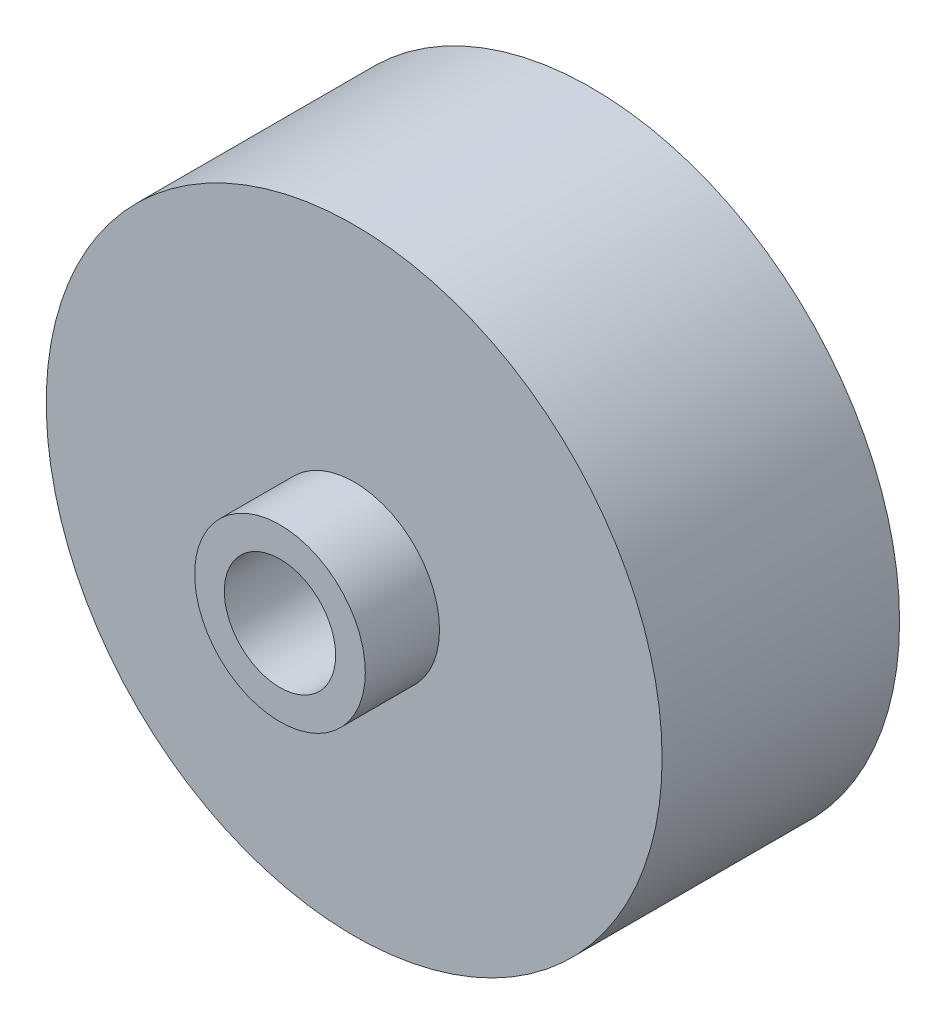
from build123d import *


with BuildPart() as part:
    # Эскиз1 → Повернуть1 (revolve)
    with BuildSketch(Plane(origin=(0, 0, 0), x_dir=(1, 0, 0), z_dir=(0, 1, 0))):
        Polygon((3.75, -21), (5.75, -21), (5.75, -16), (20.75, -16), (20.75, 0), (3.75, 0), align=None)
    revolve(axis=Axis((0, 0, 0), (0, 0, 1)))


solid = part.part
